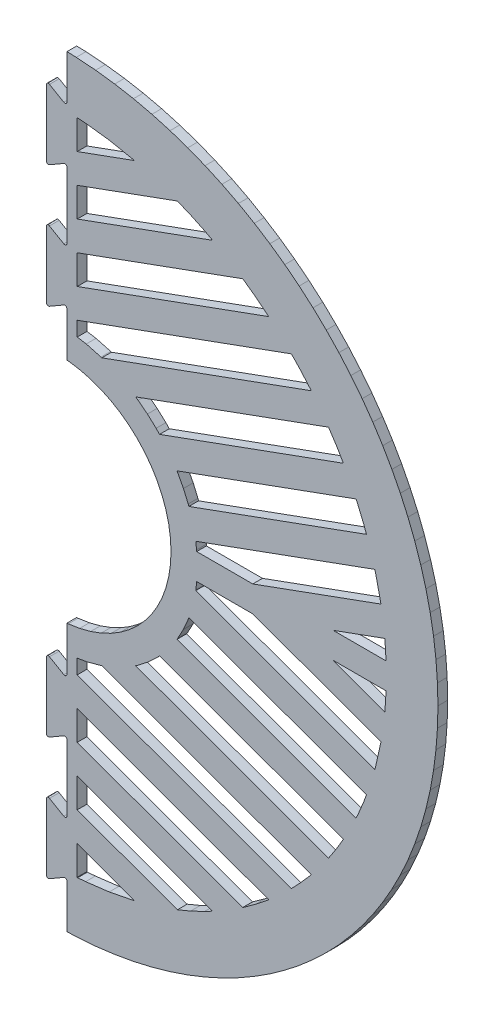
from build123d import *

# Parameters (mm, degrees)
BOSS_EXTRUDE1_DEPTH     = 3
SKETCH1_W               = 12.7
SKETCH1_H               = 78.71724042
BOSS_EXTRUDE2_DEPTH     = 3
CUT_EXTRUDE1_DEPTH      = 167.338711832
CUT_EXTRUDE1_DEPTH_BACK = 167.338711832
FILLET1_R               = 0.635


with BuildPart() as part:
    # Model → Boss-Extrude1 (new body)
    with BuildSketch(Plane.XY):
        Polygon((0, 117.60010003), (6.051687029, 117.447079513), (12.023921543, 116.992944005), (17.909328885, 116.245082492), (23.700512865, 115.210884088), (29.39008806, 113.897737665), (34.970669047, 112.313032431), (40.43484887, 110.464157343), (45.775263638, 108.358501524), (50.984495629, 106.003453763), (56.055180952, 103.40640352), (60.979923418, 100.574739583), (65.751326836, 97.515850067), (70.362005785, 94.237125778), (74.804585605, 90.745954831), (79.071637811, 87.049725342), (83.155820041, 83.155828116), (87.049725342, 79.071651268), (90.745946757, 74.804585605), (94.237120395, 70.362016551), (97.515839301, 65.751332219), (100.574739583, 60.979928801), (103.406392754, 56.055191718), (106.003456455, 50.984506395), (108.358502197, 45.775269021), (110.46416609, 40.434859636), (112.313041178, 34.97067443), (113.897742038, 29.390098826), (115.210883247, 23.700523631), (116.24507938, 17.90933965), (116.992945014, 12.023932309), (117.447073195, 6.051687029), (117.60010003, 0), (117.447073195, -6.051687029), (116.992945014, -12.023921543), (116.24507938, -17.909328885), (115.210883247, -23.700512865), (113.897742038, -29.39008806), (112.313041178, -34.970669047), (110.46416609, -40.43484887), (108.358502197, -45.775263638), (106.003456455, -50.984495629), (103.406392754, -56.055180952), (100.574739583, -60.979923418), (97.515839301, -65.751326836), (94.237120395, -70.362005785), (90.745946757, -74.804585605), (87.049725342, -79.071637811), (83.155820041, -83.155820041), (79.071637811, -87.049725342), (74.804585605, -90.745946757), (70.362005785, -94.237120395), (65.751326836, -97.515839301), (60.979923418, -100.574739583), (56.055180952, -103.406392754), (50.984495629, -106.003456455), (45.775263638, -108.358502197), (40.43484887, -110.46416609), (34.970669047, -112.313041178), (29.39008806, -113.897742038), (23.700512865, -115.210883247), (17.909328885, -116.24507938), (12.023921543, -116.992945014), (6.051687029, -117.447073195), (0, -117.60010003), (-6.051687029, -117.447073195), (-12.023932309, -116.992945014), (-17.90933965, -116.24507938), (-23.700523631, -115.210883247), (-29.390098826, -113.897742038), (-34.97067443, -112.313041178), (-40.434859636, -110.46416609), (-45.775269021, -108.358502197), (-50.984506395, -106.003456455), (-56.055191718, -103.406392754), (-60.979928801, -100.574739583), (-65.751332219, -97.515839301), (-70.362016551, -94.237120395), (-74.804585605, -90.745946757), (-79.071651268, -87.049725342), (-83.155828116, -83.155820041), (-87.049725342, -79.071637811), (-90.745954831, -74.804585605), (-94.237125778, -70.362005785), (-97.515850067, -65.751326836), (-100.574739583, -60.979923418), (-103.40640352, -56.055180952), (-106.003453763, -50.984495629), (-108.358501524, -45.775263638), (-110.464157343, -40.43484887), (-112.313032431, -34.970669047), (-113.897737665, -29.39008806), (-115.210884088, -23.700512865), (-116.245082492, -17.909328885), (-116.992944005, -12.023921543), (-117.447079513, -6.051687029), (-117.60010003, 0), (-117.447079513, 6.051687029), (-116.992944005, 12.023932309), (-116.245082492, 17.90933965), (-115.210884088, 23.700523631), (-113.897737665, 29.390098826), (-112.313032431, 34.97067443), (-110.464157343, 40.434859636), (-108.358501524, 45.775269021), (-106.003453763, 50.984506395), (-103.40640352, 56.055191718), (-100.574739583, 60.979928801), (-97.515850067, 65.751332219), (-94.237125778, 70.362016551), (-90.745954831, 74.804585605), (-87.049725342, 79.071651268), (-83.155828116, 83.155828116), (-79.071651268, 87.049725342), (-74.804585605, 90.745954831), (-70.362016551, 94.237125778), (-65.751332219, 97.515850067), (-60.979928801, 100.574739583), (-56.055191718, 103.40640352), (-50.984506395, 106.003453763), (-45.775269021, 108.358501524), (-40.434859636, 110.464157343), (-34.97067443, 112.313032431), (-29.390098826, 113.897737665), (-23.700523631, 115.210884088), (-17.90933965, 116.245082492), (-12.023932309, 116.992944005), (-6.051687029, 117.447079513), align=None)
        Polygon((-29.102476417, -97.366666667), (-27.13528383, -97.936097887), (-21.809747569, -99.25361006), (-16.377897814, -100.286923387), (-10.84801356, -101.02776964), (-5.228330739, -101.467880588), (-4.000003476, -101.514561632), (-4.000003476, -97.366666667), align=None, mode=Mode.SUBTRACT)
        Polygon((4.000003476, -91.556276279), (4.000003476, -100.566299099), (6.492250146, -101.473414273), (8.939925893, -101.290264384), (16.222340986, -100.392924669), (23.335321977, -98.992902459), (23.988802762, -98.831607395), align=None, mode=Mode.SUBTRACT)
        Polygon((-62.045190006, -80.433333333), (-59.311867396, -82.499830797), (-55.403896417, -85.178564792), (-51.367676375, -87.676991102), (-49.168106715, -88.9), (-4.000003476, -88.9), (-4.000003476, -80.433333333), align=None, mode=Mode.SUBTRACT)
        Polygon((4.000003476, -73.536187575), (4.000003476, -82.546231927), (37.246940528, -94.647129822), (41.334126451, -92.942776489), (45.583867052, -90.933424547), (48.111652035, -89.591516791), align=None, mode=Mode.SUBTRACT)
        Polygon((-79.298769188, -63.5), (-76.724758021, -66.604827711), (-73.545115217, -70.098003811), (-71.679238044, -71.966666667), (-4.000003476, -71.966666667), (-4.000003476, -63.5), align=None, mode=Mode.SUBTRACT)
        Polygon((4.000003476, -55.516109636), (4.000003476, -64.526164754), (57.399392615, -83.961950853), (57.645361667, -83.800741916), (61.41833335, -81.073281352), (65.058410475, -78.180004035), (65.414762539, -77.869256422), align=None, mode=Mode.SUBTRACT)
        Polygon((-90.310844655, -46.566666667), (-90.060738797, -47.072880385), (-87.754516517, -51.23540624), (-85.411504385, -55.033333333), (-4.000003476, -55.033333333), (-4.000003476, -46.566666667), align=None, mode=Mode.SUBTRACT)
        Polygon((13.918390316, -41.106039598), (13.664583672, -41.196311866), (9.141485511, -42.427007633), (4.436540137, -43.167638567), (4.000003476, -43.200829909), (4.000003476, -46.50607605), (72.408327908, -71.404685465), (75.126379055, -68.560113186), (78.180004035, -65.058410475), (78.527118937, -64.621701558), align=None, mode=Mode.SUBTRACT)
        Polygon((-97.207060507, -29.633333333), (-96.581674745, -31.625018395), (-95.803612041, -33.909773424), (-94.207018873, -38.1), (-20.760403781, -38.1), (-21.484821235, -37.70790507), (-23.989459483, -36.162822808), (-26.377653503, -34.45647778), (-28.641840235, -32.596470727), (-30.774429703, -30.590380859), (-31.684171761, -29.633333333), align=None, mode=Mode.SUBTRACT)
        Polygon((31.745338355, -29.574432966), (30.682537164, -30.682537164), (28.000917901, -33.14915017), (25.118880208, -35.386126031), (24.365470123, -35.898422496), (83.861224874, -57.553097704), (86.35691664, -53.744964515), (88.446776157, -50.212072923), align=None, mode=Mode.SUBTRACT)
        Polygon((40.777603573, -14.841837396), (40.573212518, -15.41651162), (39.112771946, -18.812073093), (37.378876919, -22.051065742), (37.093676843, -22.511029053), (92.335944451, -42.617575243), (92.942776489, -41.334137217), (94.758880107, -36.978922865), (95.557173326, -34.779972246), align=None, mode=Mode.SUBTRACT)
        Polygon((-100.812206247, -12.7), (-100.500605435, -14.999364387), (-99.660932043, -19.855226474), (-99.384550603, -21.166666667), (-37.885279041, -21.166666667), (-38.763756858, -19.519824897), (-40.007425563, -16.829129961), (-41.068956375, -14.04289822), (-41.493451352, -12.7), align=None, mode=Mode.SUBTRACT)
        Polygon((85.25455068, -4.000003476), (101.204567634, -9.805333879), (101.290264384, -8.939936659), (101.600086127, -4.000003476), align=None, mode=Mode.SUBTRACT)
        Polygon((43.200829909, -4.000003476), (43.167638567, -4.436540137), (42.932015567, -6.33851276), (42.887875281, -6.599877082), (98.134040154, -26.707844374), (98.417722236, -25.665466139), (99.981192695, -18.613075765), (100.020574443, -18.38443985), (60.499677107, -4.000003476), align=None, mode=Mode.SUBTRACT)
        Polygon((-101.506635221, 4.233333333), (-101.568938965, 2.540639496), (-101.600086127, 0), (-101.568938965, -2.540639496), (-101.506635221, -4.233333333), (-43.186177487, -4.233333333), (-43.194574907, -4.162784237), (-43.342019611, -2.09420895), (-43.39167205, 0), (-43.342019611, 2.09420895), (-43.194574907, 4.162795003), (-43.186177487, 4.233333333), align=None, mode=Mode.SUBTRACT)
        Polygon((101.204567634, 9.805344645), (85.25455068, 4.000003476), (101.600086127, 4.000003476), (101.290264384, 8.939936659), align=None, mode=Mode.SUBTRACT)
        Polygon((-99.384550603, 21.166666667), (-99.660932043, 19.855226474), (-100.500605435, 14.999364387), (-100.812206247, 12.7), (-41.493451352, 12.7), (-41.068956375, 14.04289822), (-40.007425563, 16.829140727), (-38.763756858, 19.519835663), (-37.885279041, 21.166666667), align=None, mode=Mode.SUBTRACT)
        Polygon((98.134040154, 26.707833608), (42.887886047, 6.599877082), (42.932015567, 6.338523526), (43.167638567, 4.436550903), (43.200829909, 4.000003476), (60.499677107, 4.000003476), (100.020574443, 18.384429084), (99.981192695, 18.613075765), (98.417722236, 25.665455373), align=None, mode=Mode.SUBTRACT)
        Polygon((0, 35.277783161), (-3.606950378, 35.095645269), (-7.10970815, 34.561063343), (-10.490531074, 33.691763475), (-13.731709205, 32.505482525), (-16.815489536, 31.019946586), (-19.724140591, 29.252892515), (-22.439941661, 27.222057173), (-24.945161268, 24.945161268), (-27.222057173, 22.439941661), (-29.252892515, 19.724140591), (-31.019946586, 16.815489536), (-32.505482525, 13.731709205), (-33.691763475, 10.490531074), (-34.561063343, 7.10970815), (-35.095645269, 3.606950378), (-35.277783161, 0), (-35.095645269, -3.606950378), (-34.561063343, -7.109697384), (-33.691763475, -10.490531074), (-32.505482525, -13.731698439), (-31.019946586, -16.81547877), (-29.252892515, -19.724140591), (-27.222057173, -22.439941661), (-24.945161268, -24.945150503), (-22.439941661, -27.222046407), (-19.724140591, -29.252887132), (-16.815489536, -31.019941203), (-13.731709205, -32.505477142), (-10.490531074, -33.691763475), (-7.10970815, -34.56105796), (-3.606950378, -35.095639886), (0, -35.277777778), (3.606950378, -35.095639886), (7.109697384, -34.56105796), (10.490531074, -33.691763475), (13.731698439, -32.505477142), (16.81547877, -31.019941203), (19.724140591, -29.252887132), (22.439941661, -27.222046407), (24.945150503, -24.945150503), (27.222046407, -22.439941661), (29.252887132, -19.724140591), (31.019941203, -16.81547877), (32.505477142, -13.731698439), (33.691763475, -10.490531074), (34.56105796, -7.109697384), (35.095639886, -3.606950378), (35.277777778, 0), (35.095639886, 3.606950378), (34.56105796, 7.10970815), (33.691763475, 10.490531074), (32.505477142, 13.731709205), (31.019941203, 16.815489536), (29.252887132, 19.724140591), (27.222046407, 22.439941661), (24.945150503, 24.945161268), (22.439941661, 27.222057173), (19.724140591, 29.252892515), (16.81547877, 31.019946586), (13.731698439, 32.505482525), (10.490531074, 33.691763475), (7.109697384, 34.561063343), (3.606950378, 35.095645269), align=None, mode=Mode.SUBTRACT)
        Polygon((-94.207016182, 38.100005383), (-95.803612041, 33.909768041), (-96.581674745, 31.625018395), (-97.207056469, 29.633338716), (-31.684171761, 29.633338716), (-30.774429703, 30.590391625), (-28.641840235, 32.596481493), (-26.377653503, 34.456488546), (-23.989459483, 36.162828191), (-21.484821235, 37.707915836), (-20.760403781, 38.100005383), align=None, mode=Mode.SUBTRACT)
        Polygon((92.335944451, 42.61756986), (37.093687609, 22.511029053), (37.378876919, 22.051076508), (39.112771946, 18.812083859), (40.573212518, 15.416522386), (40.777603573, 14.841837396), (95.557173326, 34.779972246), (94.758880107, 36.978922865), (92.942776489, 41.334126451), align=None, mode=Mode.SUBTRACT)
        Polygon((-85.411499002, 55.033338716), (-87.754516517, 51.23540624), (-90.060738797, 47.072880385), (-90.310841963, 46.56667205), (-4.000003476, 46.56667205), (-4.000003476, 55.033338716), align=None, mode=Mode.SUBTRACT)
        Polygon((83.861203342, 57.553103087), (24.365470123, 35.898422496), (25.118880208, 35.386136797), (28.000917901, 33.149155553), (30.682537164, 30.682542547), (31.745338355, 29.574438349), (88.446776157, 50.212072923), (86.35691664, 53.744959132), align=None, mode=Mode.SUBTRACT)
        Polygon((72.408327908, 71.404680083), (4.000003476, 46.506081433), (4.000003476, 43.200840675), (4.436540137, 43.16764395), (9.141485511, 42.427018399), (13.664583672, 41.196322632), (13.918411848, 41.106044981), (78.527118937, 64.621696175), (78.180004035, 65.058410475), (75.126379055, 68.56010242), align=None, mode=Mode.SUBTRACT)
        Polygon((-71.679232661, 71.96667205), (-73.545115217, 70.098009194), (-76.724758021, 66.604833094), (-79.298761113, 63.500005383), (-4.000003476, 63.500005383), (-4.000003476, 71.96667205), align=None, mode=Mode.SUBTRACT)
        Polygon((57.399392615, 83.96194547), (4.000003476, 64.526159371), (4.000003476, 55.516120402), (65.414741007, 77.869259114), (65.058410475, 78.179995961), (61.41833335, 81.073281352), (57.645361667, 83.800749991), align=None, mode=Mode.SUBTRACT)
        Polygon((-49.168106715, 88.900002691), (-51.367676375, 87.676985719), (-55.403896417, 85.178562101), (-59.311867396, 82.499833488), (-62.045190006, 80.433336025), (-4.000003476, 80.433336025), (-4.000003476, 88.900002691), align=None, mode=Mode.SUBTRACT)
        Polygon((37.246929762, 94.64712713), (4.000003476, 82.546229235), (4.000003476, 73.536201032), (48.111641269, 89.591522174), (45.583867052, 90.933419164), (41.334126451, 92.942771106), align=None, mode=Mode.SUBTRACT)
        Polygon((6.492250146, 101.473410236), (4.000003476, 100.56630852), (4.000003476, 91.556270896), (23.988813527, 98.831602012), (23.335321977, 98.992911879), (16.222340986, 100.392930052), (8.939925893, 101.290272458), align=None, mode=Mode.SUBTRACT)
        Polygon((-4.000003476, 101.514556249), (-5.228330739, 101.46788328), (-10.84801356, 101.027766948), (-16.377897814, 100.286920696), (-21.809747569, 99.25361006), (-27.13528383, 97.936097887), (-29.1024818, 97.366669358), (-4.000003476, 97.366669358), align=None, mode=Mode.SUBTRACT)
    extrude(amount=BOSS_EXTRUDE1_DEPTH)

    # Sketch1 → Boss-Extrude2 (add)
    with BuildSketch(Plane.XY.offset(3)):
        with Locations((0, -74.636403371)):
            Rectangle(SKETCH1_W, SKETCH1_H)
        with Locations((0, 74.636403371)):
            Rectangle(SKETCH1_W, SKETCH1_H)
    extrude(amount=-BOSS_EXTRUDE2_DEPTH)

    # Sketch4 → Cut-Extrude1 (cut, two sides: drawn at the far end of the back side and taken through both)
    with BuildSketch(Plane.XY.offset(3).offset(-CUT_EXTRUDE1_DEPTH_BACK)):
        Polygon((-3.175, 106.631290014), (-3.175, 84.058941595), (3.175, 87.725115805), (3.175, 65.152767386), (-3.175, 68.818941595), (-3.175, 46.246593177), (3.175, 49.912767386), (3.175, -49.912767386), (-3.175, -46.246593177), (-3.175, -68.818941595), (3.175, -65.152767386), (3.175, -87.725115805), (-3.175, -84.058941595), (-3.175, -106.631290014), (3.175, -102.965115805), (3.175, -252.374161815), (-257.094091554, -252.374161815), (-257.094091554, 252.374161815), (3.175, 252.374161815), (3.175, 102.965115805), align=None)
    extrude(amount=CUT_EXTRUDE1_DEPTH + CUT_EXTRUDE1_DEPTH_BACK, mode=Mode.SUBTRACT)

    # Fillet1
    fillet1_edges = [part.edges().sort_by_distance(p)[0] for p in [
        (3.175, 49.912767386, 1.5),
        (3.175, -49.912767386, 1.5),
        (-3.175, -46.246593177, 1.5),
        (-3.175, -68.818941595, 1.5),
        (3.175, -65.152767386, 1.5),
        (3.175, -87.725115805, 1.5),
        (-3.175, -84.058941595, 1.5),
        (-3.175, -106.631290014, 1.5),
        (3.175, -102.965115805, 1.5),
        (3.175, 102.965115805, 1.5),
        (-3.175, 106.631290014, 1.5),
        (-3.175, 84.058941595, 1.5),
        (3.175, 87.725115805, 1.5),
        (3.175, 65.152767386, 1.5),
        (-3.175, 68.818941595, 1.5),
        (-3.175, 46.246593177, 1.5),
    ]]
    fillet(fillet1_edges, radius=FILLET1_R)


solid = part.part
